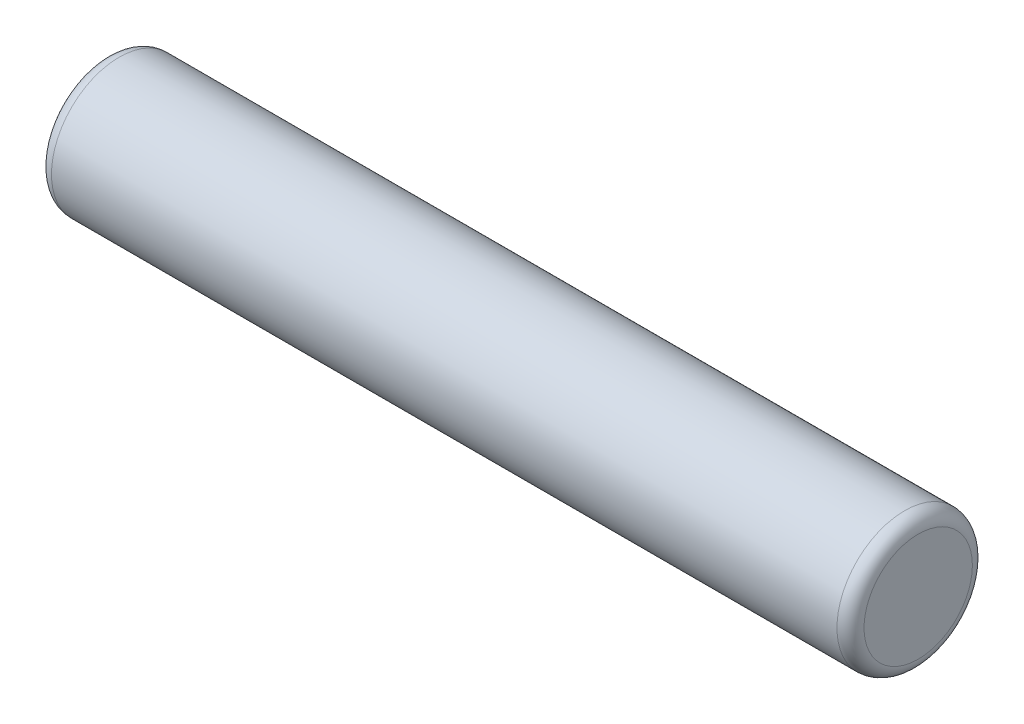
from build123d import *

# Parameters (mm, degrees)
SKIZZE1_R                       = 5
AUFSATZ_LINEAR_AUSTRAGEN1_DEPTH = 60
VERRUNDUNG3_R                   = 1


with BuildPart() as part:
    # Skizze1 → Aufsatz-Linear austragen1 (new body)
    with BuildSketch(Plane(origin=(0, 0, 0), x_dir=(0, 0, -1), z_dir=(1, 0, 0))):
        Circle(SKIZZE1_R)
    extrude(amount=AUFSATZ_LINEAR_AUSTRAGEN1_DEPTH)

    # Verrundung3
    verrundung3_edges = [part.edges().sort_by_distance(p)[0] for p in [
        (0, 0, 5),
        (60, 0, 5),
    ]]
    fillet(verrundung3_edges, radius=VERRUNDUNG3_R)


solid = part.part
